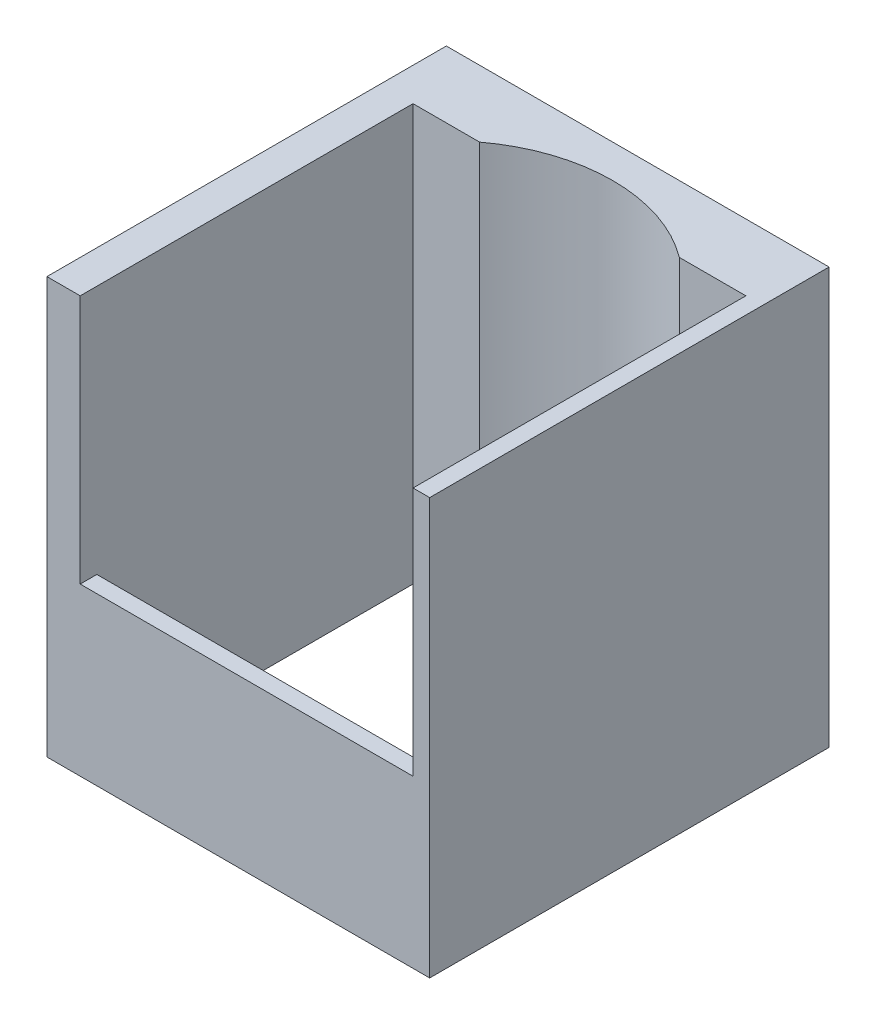
from build123d import *

# Parameters (mm, degrees)
SKETCH1_W                      = 670
SKETCH1_H                      = 120
BOSS_EXTRUDE1_DEPTH            = 530
SKETCH2_W                      = 100
SKETCH2_H                      = 200
SKETCH2_W_2                    = 650
SKETCH2_H_2                    = 250
CUT_EXTRUDE1_DEPTH             = 100
SKETCH3_R                      = 50
CUT_EXTRUDE2_DEPTH             = 260
F_12_0_12_DIAMETER_HOLE2_D     = 12
F_12_0_12_DIAMETER_HOLE2_DEPTH = 30
F_12_0_12_DIAMETER_HOLE2_TIP   = 3.605163714
SKETCH8_W                      = 650
SKETCH8_H                      = 50
BOSS_EXTRUDE2_DEPTH            = 5
SKETCH9_W                      = 10
SKETCH9_H                      = 250
CUT_EXTRUDE3_DEPTH             = 717
CUT_EXTRUDE4_DEPTH             = 5
SKETCH11_W                     = 10
SKETCH11_H                     = 100
BOSS_EXTRUDE3_DEPTH            = 78
BOSS_EXTRUDE3_2_DEPTH          = 78
BOSS_EXTRUDE3_3_DEPTH          = 78
SKETCH12_W                     = 20
SKETCH12_H                     = 30
CUT_EXTRUDE5_DEPTH             = 80
SKETCH15_W                     = 30
SKETCH15_H                     = 23.536156656
SKETCH15_H_2                   = 28.986603691
CUT_EXTRUDE7_DEPTH             = 35
SHELL1_T                       = -3
SKETCH16_W                     = 14
SKETCH16_H                     = 14
CUT_EXTRUDE8_DEPTH             = 35
SKETCH17_W                     = 5.729882812
SKETCH17_H                     = 17.428393554
SKETCH17_W_2                   = 13.369726562
SKETCH17_H_2                   = 3.342431641
BOSS_EXTRUDE4_DEPTH            = 5
SKETCH18_W                     = 670
SKETCH18_H                     = 280
CUT_EXTRUDE10_DEPTH            = 159
CUT_EXTRUDE11_DEPTH            = 863.670273187
CUT_EXTRUDE11_DEPTH_BACK       = 863.670273187
SKETCH19_W                     = 555
SKETCH19_H                     = 250
CUT_EXTRUDE12_DEPTH            = 556.450267801
CUT_EXTRUDE12_DEPTH_BACK       = 556.450267801
SKETCH20_W                     = 115
SKETCH20_H                     = 125


with BuildPart() as part:
    # Sketch1 → Boss-Extrude1 (new body)
    with BuildSketch(Plane(origin=(0, 0, 0), x_dir=(1, 0, 0), z_dir=(0, 1, 0))):
        with Locations((335, 60)):
            Rectangle(SKETCH1_W, SKETCH1_H)
    extrude(amount=BOSS_EXTRUDE1_DEPTH)

    # Sketch2 → Cut-Extrude1 (cut)
    with BuildSketch(Plane.XY):
        with Locations((60, 380)):
            Rectangle(SKETCH2_W, SKETCH2_H)
        with Locations((170, 380)):
            Rectangle(SKETCH2_W, SKETCH2_H)
        with Locations((280, 380)):
            Rectangle(SKETCH2_W, SKETCH2_H)
        with Locations((390, 380)):
            Rectangle(SKETCH2_W, SKETCH2_H)
        with Locations((500, 380)):
            Rectangle(SKETCH2_W, SKETCH2_H)
        with Locations((610, 380)):
            Rectangle(SKETCH2_W, SKETCH2_H)
        with Locations((335, 135)):
            Rectangle(SKETCH2_W_2, SKETCH2_H_2)
    extrude(amount=-CUT_EXTRUDE1_DEPTH, mode=Mode.SUBTRACT)

    # Sketch3 → Cut-Extrude2 (cut)
    with BuildSketch(Plane(origin=(0, 530, 0), x_dir=(1, 0, 0), z_dir=(0, 1, 0))):
        with Locations(Location((60, 60, 0), (0, 0, 270))):
            Circle(SKETCH3_R)
        with Locations(Location((170, 60, 0), (0, 0, 270))):
            Circle(SKETCH3_R)
        with Locations(Location((280, 60, 0), (0, 0, 270))):
            Circle(SKETCH3_R)
        with Locations(Location((390, 60, 0), (0, 0, 270))):
            Circle(SKETCH3_R)
        with Locations(Location((500, 60, 0), (0, 0, 270))):
            Circle(SKETCH3_R)
        with Locations(Location((610, 60, 0), (0, 0, 270))):
            Circle(SKETCH3_R)
    extrude(amount=-CUT_EXTRUDE2_DEPTH, mode=Mode.SUBTRACT)

    # Ø12.0 (12) Diameter Hole2
    with Locations(Plane(origin=(59.704642413, 270, -102.411697903), x_dir=(0, 0, 1), z_dir=(0, 1, 0))):
        with Locations((0, 0), (-0.195888006, 111.8520513), (0.014838595, 221.167624818), (-0.341843303, 331.364008353), (0.657723149, 441.008646429), (1.288998006, 549.811854685)):
            Hole(F_12_0_12_DIAMETER_HOLE2_D / 2, depth=F_12_0_12_DIAMETER_HOLE2_DEPTH)
            with Locations((0, 0, -(F_12_0_12_DIAMETER_HOLE2_DEPTH + F_12_0_12_DIAMETER_HOLE2_TIP / 2))):  # 118° drill point
                Cone(0, F_12_0_12_DIAMETER_HOLE2_D / 2, F_12_0_12_DIAMETER_HOLE2_TIP, mode=Mode.SUBTRACT)

    # Sketch8 → Boss-Extrude2 (add)
    with BuildSketch(Plane.XY):
        with Locations((335, 305)):
            Rectangle(SKETCH8_W, SKETCH8_H)
    extrude(amount=-BOSS_EXTRUDE2_DEPTH)

    # Sketch9 → Cut-Extrude3 (cut)
    with BuildSketch(Plane(origin=(670, 0, 0), x_dir=(0, 0, -1), z_dir=(1, 0, 0))):
        with Locations((15, 135)):
            Rectangle(SKETCH9_W, SKETCH9_H)
    extrude(amount=-CUT_EXTRUDE3_DEPTH, mode=Mode.SUBTRACT)

    # Sketch10 → Cut-Extrude4 (cut)
    with BuildSketch(Plane(origin=(0, 10, 0), x_dir=(1, 0, 0), z_dir=(0, 1, 0))):
        Polygon((365, 61.943560596), (350, 87.924322709), (320, 87.924322709), (305, 61.943560596), (320, 35.962798482), (350, 35.962798482), align=None)
    extrude(amount=-CUT_EXTRUDE4_DEPTH, mode=Mode.SUBTRACT)

    # Sketch12 → Cut-Extrude5 (cut)
    with BuildSketch(Plane.XY.offset(-100)):
        with Locations((85.198613037, 245)):
            Rectangle(SKETCH12_W, SKETCH12_H)
        with Locations((195.198613037, 245)):
            Rectangle(SKETCH12_W, SKETCH12_H)
        with Locations((305.198613037, 245)):
            Rectangle(SKETCH12_W, SKETCH12_H)
        with Locations((415.198613037, 245)):
            Rectangle(SKETCH12_W, SKETCH12_H)
        with Locations((525.198613037, 245)):
            Rectangle(SKETCH12_W, SKETCH12_H)
        with Locations((635.198613037, 245)):
            Rectangle(SKETCH12_W, SKETCH12_H)
    extrude(amount=-CUT_EXTRUDE5_DEPTH, mode=Mode.SUBTRACT)

    # Sketch17 → Boss-Extrude4 (add)
    # profile 1 of 9: a face of its own
    with BuildSketch(Plane.XY):
        with BuildLine():
            Line((527.508830928, 289.835452458), (527.508830928, 307.263846012))
            Line((527.508830928, 307.263846012), (534.861434459, 307.263846012))
            add(Edge.make_bspline(
                [(534.861434459, 307.263846012), (535.181337774, 307.258256848), (535.803061116, 307.24739446), (536.703508491, 307.139069344), (537.544992916, 306.975202489), (538.325061607, 306.737496792), (539.040841948, 306.426020155), (539.698044515, 306.051894954), (540.290333057, 305.605079277), (540.822348212, 305.090232636), (541.284521701, 304.502523111), (541.692171296, 303.852565801), (542.030284458, 303.129762281), (542.309377095, 302.341316546), (542.5243908, 301.484161689), (542.679660381, 300.560045938), (542.773357357, 299.567500804), (542.783368073, 298.883107022), (542.788518428, 298.530997273)],
                knots=[0, 0, 0, 0, 1.135059408, 2.20595691, 3.214417064, 4.174978569, 5.094187092, 5.980001006, 6.853065862, 7.720814779, 8.600404634, 9.50058483, 10.438414914, 11.426825708, 12.465239141, 13.571113463, 14.750376389, 16, 16, 16, 16], degree=3))
            add(Edge.make_bspline(
                [(542.788518428, 298.530997273), (542.781740751, 298.180151665), (542.768592871, 297.499553336), (542.676885992, 296.511518461), (542.516733301, 295.591080531), (542.296748778, 294.736450427), (542.003051046, 293.953120444), (541.654236167, 293.233205539), (541.233025793, 292.585291498), (540.753136904, 292.000029304), (540.204772188, 291.484681411), (539.587651059, 291.044279297), (538.910779309, 290.668464036), (538.169670382, 290.361903209), (537.364073889, 290.124869172), (536.495133477, 289.954199984), (535.562644449, 289.853487388), (534.920131033, 289.841584621), (534.58911581, 289.835452458)],
                knots=[0, 0, 0, 0, 1.228418252, 2.382983832, 3.470276728, 4.496757894, 5.468023682, 6.394867725, 7.292157164, 8.167372942, 9.039072913, 9.918728341, 10.815246345, 11.744296628, 12.720973084, 13.750736166, 14.841206188, 16, 16, 16, 16], degree=3))
            Line((534.58911581, 289.835452458), (527.508830928, 289.835452458))
        make_face()
        with BuildLine():
            Line((533.238713741, 291.745413395), (534.048208904, 291.745413395))
            add(Edge.make_bspline(
                [(534.048208904, 291.745413395), (534.172894012, 291.749291978), (534.413033311, 291.756761998), (534.758676231, 291.825976613), (535.075745017, 291.938271137), (535.365749176, 292.094802589), (535.623404602, 292.300450923), (535.848862806, 292.551404902), (536.04776914, 292.844737637), (536.217685755, 293.190205032), (536.364284647, 293.596533622), (536.481764702, 294.076367921), (536.592118304, 294.630928744), (536.673672739, 295.265507643), (536.740044562, 295.978448886), (536.788346679, 296.768428292), (536.812018936, 297.636801208), (536.817188964, 298.241258393), (536.819890499, 298.55711002)],
                knots=[0, 0, 0, 0, 0.728710832, 1.403472396, 2.052289494, 2.690292559, 3.321919393, 3.970736491, 4.656696891, 5.388631723, 6.217040872, 7.17856157, 8.275589967, 9.523440737, 10.918935818, 12.463926104, 14.152268318, 16, 16, 16, 16], degree=3))
            add(Edge.make_bspline(
                [(536.819890499, 298.55711002), (536.8171426, 298.871715251), (536.811863063, 299.476166083), (536.7886758, 300.343334385), (536.739579947, 301.133216935), (536.674703848, 301.843934916), (536.589660404, 302.476324031), (536.488366458, 303.031681737), (536.362441588, 303.507627045), (536.222158727, 303.914921549), (536.050140993, 304.256514038), (535.858357073, 304.554097881), (535.62547107, 304.79746827), (535.36991257, 305.004888479), (535.079348843, 305.160875844), (534.761320266, 305.273944358), (534.414185903, 305.34216807), (534.172870641, 305.349893944), (534.048208904, 305.353885075)],
                knots=[0, 0, 0, 0, 1.842836665, 3.540640921, 5.080358154, 6.47765669, 7.719902824, 8.816971715, 9.781579111, 10.601733135, 11.334613876, 12.017393917, 12.666641099, 13.29908421, 13.937911793, 14.587567384, 15.270347425, 16, 16, 16, 16], degree=3))
            Line((534.048208904, 305.353885075), (533.238713741, 305.353885075))
            Line((533.238713741, 305.353885075), (533.238713741, 291.745413395))
        make_face(mode=Mode.SUBTRACT)
    # profile 2 of 9: a face of its own
    with BuildSketch(Plane.XY):
        with Locations((547.563420772, 298.549649235)):
            Rectangle(SKETCH17_W, SKETCH17_H)
    # profile 3 of 9: a face of its own
    with BuildSketch(Plane.XY):
        Polygon((564.514324092, 307.263846012), (564.514324092, 305.115139958), (558.545696163, 305.115139958), (558.545696163, 299.862747379), (563.559343624, 299.862747379), (563.559343624, 297.714041325), (558.545696163, 297.714041325), (558.545696163, 289.835452458), (552.81581335, 289.835452458), (552.81581335, 307.263846012), align=None)
    # profile 4 of 9: a face of its own
    with BuildSketch(Plane.XY):
        Polygon((577.645305538, 307.263846012), (577.645305538, 305.115139958), (571.676677608, 305.115139958), (571.676677608, 299.862747379), (576.690325069, 299.862747379), (576.690325069, 297.714041325), (571.676677608, 297.714041325), (571.676677608, 289.835452458), (565.946794795, 289.835452458), (565.946794795, 307.263846012), align=None)
    # profile 5 of 9: a face of its own
    with BuildSketch(Plane.XY):
        with Locations((584.330168819, 287.448001286)):
            Rectangle(SKETCH17_W_2, SKETCH17_H_2)
    # profile 6 of 9: a face of its own
    with BuildSketch(Plane.XY):
        with BuildLine():
            Line((605.578484249, 307.263846012), (605.578484249, 295.602639195))
            add(Edge.make_bspline(
                [(605.578484249, 295.602639195), (605.574209777, 295.35989389), (605.565919345, 294.889083964), (605.480877158, 294.20653885), (605.349958188, 293.569747554), (605.15926554, 292.978838165), (604.911867049, 292.436847071), (604.616163877, 291.936663973), (604.260702644, 291.487723021), (603.847299908, 291.08966617), (603.386881991, 290.731670113), (602.867295001, 290.425440037), (602.293741958, 290.168488385), (601.66690529, 289.960990771), (600.988052682, 289.797299786), (600.254912883, 289.679078851), (599.467035781, 289.60781007), (598.923618241, 289.60048219), (598.643684673, 289.59670734)],
                knots=[0, 0, 0, 0, 1.108173197, 2.149326602, 3.136215123, 4.073726706, 4.978516626, 5.852185058, 6.72141202, 7.584905625, 8.467554395, 9.379216169, 10.332422268, 11.332766067, 12.390653242, 13.518530507, 14.721707419, 16, 16, 16, 16], degree=3))
            add(Edge.make_bspline(
                [(598.643684673, 289.59670734), (598.373688491, 289.600411437), (597.851346557, 289.607577482), (597.093280473, 289.679448684), (596.387523889, 289.797736542), (595.733050135, 289.960122315), (595.130189942, 290.169220301), (594.579048171, 290.42623041), (594.078350789, 290.732835498), (593.633858028, 291.090104794), (593.234289459, 291.486851767), (592.899913678, 291.940746827), (592.609043638, 292.435866034), (592.375223767, 292.980322997), (592.191754821, 293.570441519), (592.063541006, 294.20666921), (591.983676196, 294.889343196), (591.974661767, 295.359932437), (591.970012569, 295.602639195)],
                knots=[0, 0, 0, 0, 1.258901956, 2.435505865, 3.547148904, 4.59359074, 5.576649289, 6.5183682, 7.424469602, 8.307507093, 9.172751023, 10.042627298, 10.928839176, 11.845659241, 12.799442865, 13.80597989, 14.868432463, 16, 16, 16, 16], degree=3))
            Line((591.970012569, 295.602639195), (591.970012569, 307.263846012))
            Line((591.970012569, 307.263846012), (597.699895381, 307.263846012))
            Line((597.699895381, 307.263846012), (597.699895381, 295.457153889))
            add(Edge.make_bspline(
                [(597.699895381, 295.457153889), (597.700816195, 295.287996189), (597.702584578, 294.963135903), (597.729908723, 294.499051493), (597.768241004, 294.079064133), (597.828226169, 293.705517832), (597.90066041, 293.377063412), (597.989882091, 293.09281535), (598.094998068, 292.852496478), (598.225239063, 292.654232043), (598.380826623, 292.495135011), (598.55368342, 292.353231761), (598.757556996, 292.238543846), (598.987648905, 292.146224908), (599.243380948, 292.070549638), (599.526120553, 292.020376099), (599.83553351, 291.990763905), (600.049971942, 291.986424568), (600.161954402, 291.984158512)],
                knots=[0, 0, 0, 0, 1.622370975, 3.115695595, 4.458049099, 5.666011203, 6.742434742, 7.681714947, 8.519814998, 9.250928664, 9.942747364, 10.646898194, 11.389596108, 12.175933929, 13.021386247, 13.943159715, 14.925891993, 16, 16, 16, 16], degree=3))
            add(Edge.make_bspline(
                [(600.161954402, 291.984158512), (600.283927219, 291.987190593), (600.521124756, 291.993087005), (600.86597014, 292.03390861), (601.187714881, 292.103380086), (601.484890424, 292.205377303), (601.758665297, 292.332852529), (602.012761516, 292.484567923), (602.236391413, 292.674631152), (602.439076761, 292.888441291), (602.620738276, 293.128529789), (602.771757722, 293.399928575), (602.905501548, 293.697121508), (603.005823683, 294.025060118), (603.089837826, 294.379999499), (603.146989706, 294.763086929), (603.186210275, 295.174074524), (603.189394751, 295.457053988), (603.191033077, 295.602639195)],
                knots=[0, 0, 0, 0, 1.083870311, 2.107775948, 3.08105344, 4.003637981, 4.893545291, 5.761570557, 6.624657808, 7.49233129, 8.376387281, 9.291996285, 10.246843261, 11.267344133, 12.334180325, 13.486053461, 14.706643157, 16, 16, 16, 16], degree=3))
            Line((603.191033077, 295.602639195), (603.191033077, 307.263846012))
            Line((603.191033077, 307.263846012), (605.578484249, 307.263846012))
        make_face()
    # profile 7 of 9: a face of its own
    with BuildSketch(Plane.XY):
        with BuildLine():
            Line((619.731593227, 302.015183827), (616.739818477, 301.526502415))
            add(Edge.make_bspline(
                [(616.739818477, 301.526502415), (616.748849224, 301.670726223), (616.765660669, 301.939210177), (616.78429066, 302.312269209), (616.796668381, 302.625642376), (616.798628236, 302.814722915), (616.799504756, 302.899286839)],
                knots=[0, 0, 0, 0, 1.261802504, 2.348944521, 3.261585937, 4, 4, 4, 4], degree=3))
            add(Edge.make_bspline(
                [(616.799504756, 302.899286839), (616.798306068, 303.007660677), (616.795968139, 303.219033721), (616.750451916, 303.523894877), (616.694806916, 303.811547356), (616.604352699, 304.076787391), (616.488181329, 304.320314265), (616.348943917, 304.543955606), (616.184187178, 304.745078709), (615.995833421, 304.928129987), (615.778009957, 305.083200131), (615.536269472, 305.218702836), (615.269765326, 305.333844758), (614.978065514, 305.431346685), (614.660683072, 305.504624438), (614.319025281, 305.556776695), (613.952471696, 305.585673441), (613.699597795, 305.590260771), (613.568984889, 305.592630192)],
                knots=[0, 0, 0, 0, 1.079280541, 2.105035848, 3.067950317, 3.99715044, 4.889989748, 5.753421302, 6.617030865, 7.476358039, 8.364190572, 9.274590025, 10.235106994, 11.254473582, 12.337095886, 13.478601727, 14.697662529, 16, 16, 16, 16], degree=3))
            add(Edge.make_bspline(
                [(613.568984889, 305.592630192), (613.391954632, 305.58912286), (613.059112606, 305.582528579), (612.595688488, 305.495339748), (612.198743126, 305.361419257), (611.87165349, 305.163811893), (611.613188167, 304.909795747), (611.433841092, 304.593316589), (611.323009072, 304.224665915), (611.313400221, 303.959558324), (611.308367061, 303.820693775)],
                knots=[0, 0, 0, 0, 1.294917039, 2.43462794, 3.440028966, 4.347597256, 5.210608309, 6.06356377, 6.985685997, 8, 8, 8, 8], degree=3))
            add(Edge.make_bspline(
                [(611.308367061, 303.820693775), (611.317562032, 303.705133219), (611.336106628, 303.472068433), (611.47315858, 303.132808312), (611.695999602, 302.811560885), (612.009295906, 302.510664216), (612.404107796, 302.221967273), (612.884407504, 301.948533431), (613.450813789, 301.688189695), (613.862519081, 301.536023727), (614.080048656, 301.455624958)],
                knots=[0, 0, 0, 0, 0.716839541, 1.445735977, 2.240793036, 3.131329288, 4.131129903, 5.273471266, 6.559404876, 8, 8, 8, 8], degree=3))
            add(Edge.make_bspline(
                [(614.080048656, 301.455624958), (614.335934702, 301.364918412), (614.834564244, 301.188164095), (615.547657928, 300.88707802), (616.213068388, 300.5749594), (616.829579094, 300.246613346), (617.397833174, 299.90520698), (617.914851624, 299.544556457), (618.386199073, 299.173962102), (618.807001026, 298.783874588), (619.177995113, 298.378100064), (619.4958685, 297.952745357), (619.771807525, 297.51723103), (619.991113975, 297.061458502), (620.169645242, 296.594624218), (620.292698657, 296.11024444), (620.364288243, 295.609761088), (620.37516617, 295.270864226), (620.380681514, 295.099036213)],
                knots=[0, 0, 0, 0, 1.359488612, 2.649152603, 3.874964776, 5.039588756, 6.146130126, 7.193090393, 8.194917302, 9.146793662, 10.063845301, 10.944476293, 11.803344532, 12.641736646, 13.473440096, 14.302714936, 15.139439897, 16, 16, 16, 16], degree=3))
            add(Edge.make_bspline(
                [(620.380681514, 295.099036213), (620.374476075, 294.902306495), (620.362285176, 294.515820995), (620.280160209, 293.948630617), (620.138011896, 293.409496554), (619.938489338, 292.895972278), (619.681049879, 292.411946655), (619.366518754, 291.954381076), (618.996510229, 291.525099427), (618.5710008, 291.128381035), (618.102222518, 290.765302239), (617.587803957, 290.450854345), (617.034458515, 290.187092261), (616.444107988, 289.968993032), (615.81453624, 289.801373099), (615.145337453, 289.685291013), (614.438790193, 289.606619894), (613.954683001, 289.600062276), (613.70700941, 289.59670734)],
                knots=[0, 0, 0, 0, 0.972121714, 1.909782367, 2.824924061, 3.721832975, 4.62620438, 5.527836938, 6.46026819, 7.421000932, 8.398101015, 9.385579713, 10.394244048, 11.422703992, 12.491421888, 13.608778581, 14.776629625, 16, 16, 16, 16], degree=3))
            add(Edge.make_bspline(
                [(613.70700941, 289.59670734), (613.445745367, 289.599650312), (612.939893069, 289.605348413), (612.207608113, 289.66709241), (611.525297432, 289.760984454), (610.893395078, 289.899706116), (610.309273131, 290.072394336), (609.776099392, 290.288320955), (609.295310255, 290.547303481), (608.863217672, 290.843007892), (608.478306623, 291.175775461), (608.148120946, 291.551766865), (607.86942369, 291.967163224), (607.639947144, 292.421521488), (607.466477665, 292.917583541), (607.339164663, 293.449829748), (607.264537999, 294.021332449), (607.254747521, 294.414908557), (607.249700069, 294.617815586)],
                knots=[0, 0, 0, 0, 1.342201143, 2.598733168, 3.773451092, 4.878874364, 5.91991243, 6.900006476, 7.829142054, 8.72062616, 9.585588575, 10.436728592, 11.283829734, 12.149664931, 13.044964919, 13.977937424, 14.957531465, 16, 16, 16, 16], degree=3))
            add(Edge.make_bspline(
                [(607.249700069, 294.617815586), (607.250803815, 294.692425759), (607.253213998, 294.855347393), (607.260452266, 295.122772538), (607.275636683, 295.433682216), (607.29037174, 295.656130545), (607.298195171, 295.774237248)],
                knots=[0, 0, 0, 0, 0.773500207, 1.689044709, 2.77302154, 4, 4, 4, 4], degree=3))
            Line((607.298195171, 295.774237248), (610.36457777, 296.337526509))
            add(Edge.make_bspline(
                [(610.36457777, 296.337526509), (610.326952988, 296.136337493), (610.255606535, 295.754830366), (610.178678473, 295.21219969), (610.124206629, 294.733311493), (610.11767002, 294.435147371), (610.114641475, 294.297001835)],
                knots=[0, 0, 0, 0, 1.192988372, 2.262218769, 3.194850416, 4, 4, 4, 4], degree=3))
            add(Edge.make_bspline(
                [(610.114641475, 294.297001835), (610.116191817, 294.183708768), (610.119182568, 293.965156219), (610.159053378, 293.648552813), (610.215988606, 293.352999663), (610.302906772, 293.079707227), (610.411206928, 292.826307836), (610.544682453, 292.59538211), (610.704385489, 292.386485019), (610.887496571, 292.200099922), (611.094689168, 292.033628705), (611.327456494, 291.892756696), (611.58347653, 291.771733922), (611.864681562, 291.677479524), (612.167961721, 291.596080628), (612.497219749, 291.548235723), (612.849461228, 291.512043782), (613.092629543, 291.508500084), (613.218327999, 291.506668278)],
                knots=[0, 0, 0, 0, 1.135776692, 2.191015738, 3.19649269, 4.151244236, 5.061952528, 5.956281389, 6.819534407, 7.692823504, 8.571441916, 9.478554956, 10.416037156, 11.406231466, 12.450054172, 13.561596327, 14.739541482, 16, 16, 16, 16], degree=3))
            add(Edge.make_bspline(
                [(613.218327999, 291.506668278), (613.423996012, 291.510791273), (613.810619321, 291.518541853), (614.349272542, 291.616708407), (614.810575885, 291.768742445), (615.189785268, 291.991387532), (615.490778961, 292.278756613), (615.698005174, 292.637320004), (615.824813318, 293.05638326), (615.837728413, 293.355975238), (615.844524288, 293.513619419)],
                knots=[0, 0, 0, 0, 1.308765556, 2.460272085, 3.475015317, 4.388076298, 5.239673503, 6.095681635, 6.997954785, 8, 8, 8, 8], degree=3))
            add(Edge.make_bspline(
                [(615.844524288, 293.513619419), (615.833808824, 293.638242951), (615.811807312, 293.894126055), (615.644884004, 294.264515838), (615.382382362, 294.620631473), (615.016807277, 294.962984909), (614.551376589, 295.293471235), (613.986957743, 295.616730224), (613.322148235, 295.933112033), (612.83677959, 296.119639164), (612.580430889, 296.21815395)],
                knots=[0, 0, 0, 0, 0.667930748, 1.371427933, 2.146459016, 3.034714139, 4.04893387, 5.207327294, 6.525042705, 8, 8, 8, 8], degree=3))
            add(Edge.make_bspline(
                [(612.580430889, 296.21815395), (612.374354345, 296.29679374), (611.970646869, 296.450850434), (611.394079385, 296.713586304), (610.853066711, 296.987016804), (610.357486361, 297.288235735), (609.896382561, 297.599610528), (609.477036946, 297.932256792), (609.09841673, 298.284556341), (608.758710772, 298.653375077), (608.457302107, 299.038989264), (608.199448649, 299.444659231), (607.977533299, 299.866789834), (607.798609588, 300.308107488), (607.65975715, 300.767821241), (607.559616231, 301.244439392), (607.497905054, 301.739995674), (607.491630423, 302.075933546), (607.488445186, 302.246468159)],
                knots=[0, 0, 0, 0, 1.249558333, 2.447906163, 3.58867143, 4.682264114, 5.731748367, 6.739728761, 7.711906036, 8.659384707, 9.578321416, 10.481344598, 11.379544271, 12.277135726, 13.175418307, 14.097160112, 15.034047388, 16, 16, 16, 16], degree=3))
            add(Edge.make_bspline(
                [(607.488445186, 302.246468159), (607.49282555, 302.439538736), (607.501402184, 302.817565692), (607.587451154, 303.36980586), (607.719291893, 303.894921371), (607.910558542, 304.389343064), (608.156192894, 304.852853762), (608.453187669, 305.288766511), (608.804241719, 305.697593471), (609.213503754, 306.066686531), (609.657214714, 306.407618241), (610.14376173, 306.697651931), (610.658716537, 306.950861947), (611.210636666, 307.148827868), (611.791820619, 307.313252612), (612.408080529, 307.421140415), (613.056315391, 307.490701612), (613.499160755, 307.498567824), (613.725661373, 307.502591129)],
                knots=[0, 0, 0, 0, 1.01033566, 1.978209831, 2.919499157, 3.840961976, 4.746855014, 5.660740114, 6.597989116, 7.56120833, 8.541877795, 9.523498025, 10.522416858, 11.542172371, 12.589598349, 13.681636521, 14.814234488, 16, 16, 16, 16], degree=3))
            add(Edge.make_bspline(
                [(613.725661373, 307.502591129), (613.968269855, 307.498219033), (614.438190994, 307.489750488), (615.120391152, 307.426787419), (615.755073228, 307.319142339), (616.345153155, 307.171557286), (616.887304575, 306.977590666), (617.384933999, 306.742393454), (617.834452216, 306.46201507), (618.236961315, 306.139451502), (618.593086714, 305.773322851), (618.897467704, 305.361641069), (619.158701245, 304.909408454), (619.366684143, 304.412232174), (619.529870326, 303.873247147), (619.649133834, 303.29158184), (619.720420497, 302.667301443), (619.72779778, 302.236712324), (619.731593227, 302.015183827)],
                knots=[0, 0, 0, 0, 1.248314423, 2.417925914, 3.521398822, 4.558068205, 5.543720209, 6.479599284, 7.385061127, 8.263440163, 9.127722873, 10.00561236, 10.891325273, 11.808802823, 12.772251995, 13.784947978, 14.860405143, 16, 16, 16, 16], degree=3))
        make_face()
    # profile 8 of 9: a face of its own
    with BuildSketch(Plane.XY):
        Polygon((633.989153194, 307.263846012), (633.989153194, 305.115139958), (628.020525264, 305.115139958), (628.020525264, 300.340237614), (633.034172725, 300.340237614), (633.034172725, 298.191531559), (628.020525264, 298.191531559), (628.020525264, 291.984158512), (634.944133663, 291.984158512), (634.944133663, 289.835452458), (622.290642452, 289.835452458), (622.290642452, 307.263846012), align=None)
    # profile 9 of 9: a face of its own
    with BuildSketch(Plane.XY):
        with BuildLine():
            Line((636.376604366, 289.835452458), (636.376604366, 307.263846012))
            Line((636.376604366, 307.263846012), (643.990335369, 307.263846012))
            add(Edge.make_bspline(
                [(643.990335369, 307.263846012), (644.237946498, 307.261150834), (644.721600887, 307.25588639), (645.426490561, 307.189203683), (646.094808274, 307.090496236), (646.724915796, 306.949857504), (647.317873659, 306.767252686), (647.871119087, 306.542146), (648.390701058, 306.282329135), (648.864494846, 305.976472528), (649.295093616, 305.642889252), (649.669668547, 305.279483604), (649.990389523, 304.894749072), (650.250664962, 304.483256345), (650.454275633, 304.048690948), (650.59581384, 303.587791605), (650.684089268, 303.104102537), (650.695510601, 302.772834174), (650.701311397, 302.604585835)],
                knots=[0, 0, 0, 0, 1.303269877, 2.545653735, 3.724355284, 4.8584284, 5.941462088, 6.987020715, 8.000098032, 8.995332524, 9.951400474, 10.863507538, 11.737823931, 12.582415999, 13.420128714, 14.25671499, 15.114600608, 16, 16, 16, 16], degree=3))
            add(Edge.make_bspline(
                [(650.701311397, 302.604585835), (650.698282873, 302.472674957), (650.692382063, 302.215658276), (650.651041486, 301.838684287), (650.580643818, 301.480313933), (650.481036683, 301.139915259), (650.347814833, 300.820175594), (650.191279492, 300.517863507), (650.009772227, 300.230553342), (649.788675198, 299.970497982), (649.548268341, 299.722842359), (649.274558803, 299.497116911), (648.974487035, 299.288655528), (648.642526299, 299.104010513), (648.287619671, 298.928055749), (647.899038177, 298.784921972), (647.486819978, 298.644749395), (647.19793098, 298.577036306), (647.049257183, 298.54218845)],
                knots=[0, 0, 0, 0, 1.057156483, 2.059775939, 3.035078039, 3.981068617, 4.897189472, 5.80650904, 6.70770952, 7.613691521, 8.536886357, 9.470937334, 10.45233069, 11.461024139, 12.51295332, 13.623444893, 14.776929983, 16, 16, 16, 16], degree=3))
            add(Edge.make_bspline(
                [(647.049257183, 298.54218845), (647.19164695, 298.499279419), (647.467865022, 298.416041346), (647.856360945, 298.265600017), (648.211652989, 298.111536308), (648.524185739, 297.936781388), (648.807636894, 297.762122504), (649.047122259, 297.564301324), (649.255235567, 297.361673563), (649.425188343, 297.135464734), (649.570253643, 296.882344437), (649.694827156, 296.586596707), (649.815179167, 296.247423665), (649.917667348, 295.859098311), (650.004750555, 295.423699276), (650.088222437, 294.944027189), (650.153853601, 294.416024546), (650.187587341, 294.048412906), (650.2051692, 293.856815525)],
                knots=[0, 0, 0, 0, 1.149282524, 2.229462177, 3.219229774, 4.139917433, 4.995948464, 5.788695735, 6.536448429, 7.236319808, 7.968460079, 8.78645307, 9.713791991, 10.749194692, 11.887975363, 13.146018663, 14.512518948, 16, 16, 16, 16], degree=3))
            add(Edge.make_bspline(
                [(650.2051692, 293.856815525), (650.225980287, 293.627849833), (650.265975604, 293.187817268), (650.348933081, 292.554613589), (650.44386163, 291.974357025), (650.555874504, 291.44528724), (650.681301216, 290.967898855), (650.821280597, 290.540469593), (650.979920039, 290.165788217), (651.10484481, 289.941461656), (651.163880062, 289.835452458)],
                knots=[0, 0, 0, 0, 1.324580516, 2.545615266, 3.678710841, 4.711533017, 5.660403917, 6.521349952, 7.301239649, 8, 8, 8, 8], degree=3))
            Line((651.163880062, 289.835452458), (645.213904094, 289.835452458))
            add(Edge.make_bspline(
                [(645.213904094, 289.835452458), (645.12229736, 290.069847279), (644.935171241, 290.548648246), (644.7595281, 291.319414791), (644.64846922, 292.142514735), (644.635117598, 292.70994511), (644.628232479, 293.002555653)],
                knots=[0, 0, 0, 0, 0.930410518, 1.900560147, 2.917368081, 4, 4, 4, 4], degree=3))
            Line((644.628232479, 293.002555653), (644.605850124, 294.002300831))
            Line((644.605850124, 294.002300831), (644.579737377, 295.266903874))
            add(Edge.make_bspline(
                [(644.579737377, 295.266903874), (644.573694669, 295.477395004), (644.562357007, 295.872330118), (644.469348432, 296.426164013), (644.30178735, 296.894645884), (644.073222546, 297.287223005), (643.766741442, 297.590613479), (643.39104803, 297.804152917), (642.950456912, 297.93396284), (642.634664848, 297.946292392), (642.468335247, 297.952786442)],
                knots=[0, 0, 0, 0, 1.295300309, 2.430314163, 3.439929415, 4.342995669, 5.203512789, 6.060756153, 6.978588463, 8, 8, 8, 8], degree=3))
            Line((642.468335247, 297.952786442), (642.106487178, 297.952786442))
            Line((642.106487178, 297.952786442), (642.106487178, 289.835452458))
            Line((642.106487178, 289.835452458), (636.376604366, 289.835452458))
        make_face()
        with BuildLine():
            Line((642.106487178, 299.862747379), (642.617550945, 299.862747379))
            add(Edge.make_bspline(
                [(642.617550945, 299.862747379), (642.722054451, 299.865172716), (642.925280724, 299.869889229), (643.220054897, 299.898289891), (643.494111408, 299.951809873), (643.749840966, 300.021017819), (643.984372137, 300.114851792), (644.200147241, 300.225818296), (644.391160406, 300.362685327), (644.565327067, 300.516342321), (644.718148635, 300.691986294), (644.850351299, 300.889034217), (644.961199162, 301.106225057), (645.056078491, 301.342818683), (645.125883912, 301.600830857), (645.173262731, 301.879472914), (645.203404658, 302.177423605), (645.207875435, 302.383174491), (645.210173702, 302.488943669)],
                knots=[0, 0, 0, 0, 1.184986479, 2.304423995, 3.352332712, 4.347714965, 5.303263624, 6.211353909, 7.091434645, 7.960150225, 8.839440182, 9.723126897, 10.64371617, 11.599264829, 12.608232147, 13.667459739, 14.800924404, 16, 16, 16, 16], degree=3))
            add(Edge.make_bspline(
                [(645.210173702, 302.488943669), (645.207875435, 302.594712847), (645.203404658, 302.800463732), (645.173262731, 303.098414423), (645.125883912, 303.37705648), (645.056078491, 303.635068654), (644.961199162, 303.87166228), (644.850351299, 304.08885312), (644.718148635, 304.285901043), (644.565327067, 304.461545017), (644.391160406, 304.61520201), (644.200147241, 304.752069041), (643.984372137, 304.863035546), (643.749840966, 304.956869518), (643.494111408, 305.026077464), (643.220054897, 305.079597446), (642.925280724, 305.107998108), (642.722054451, 305.112714621), (642.617550945, 305.115139958)],
                knots=[0, 0, 0, 0, 1.199075596, 2.332540261, 3.391767853, 4.400735171, 5.35628383, 6.276873103, 7.160559818, 8.039849775, 8.908565355, 9.788646091, 10.696736376, 11.652285035, 12.647667288, 13.695576005, 14.815013521, 16, 16, 16, 16], degree=3))
            Line((642.617550945, 305.115139958), (642.106487178, 305.115139958))
            Line((642.106487178, 305.115139958), (642.106487178, 299.862747379))
        make_face(mode=Mode.SUBTRACT)
    extrude(amount=BOSS_EXTRUDE4_DEPTH)


with BuildPart() as body_2:
    # Sketch11 → Boss-Extrude3 (new body)
    with BuildSketch(Plane.XY.offset(-100)):
        with Locations((255, 60)):
            Rectangle(SKETCH11_W, SKETCH11_H)
    extrude(amount=BOSS_EXTRUDE3_DEPTH)


with BuildPart() as body_3:
    # Sketch11 → Boss-Extrude3 2 (new body)
    with BuildSketch(Plane.XY.offset(-100)):
        with Locations((415, 60)):
            Rectangle(SKETCH11_W, SKETCH11_H)
    extrude(amount=BOSS_EXTRUDE3_2_DEPTH)


with BuildPart() as body_4:
    # Sketch11 → Boss-Extrude3 3 (new body)
    with BuildSketch(Plane.XY.offset(-100)):
        Polygon((25, 198.45686471), (325, 145.558770497), (325, 122.01775856), (345, 122.01775856), (345, 145.558770497), (645, 198.45686471), align=None)
    extrude(amount=BOSS_EXTRUDE3_3_DEPTH)

    # Sketch15 → Cut-Extrude7 (cut)
    with BuildSketch(Plane(origin=(345, 0, 0), x_dir=(0, 0, -1), z_dir=(1, 0, 0))):
        with Locations((35, 133.231921672)):
            Rectangle(SKETCH15_W, SKETCH15_H)
        with Locations((85, 130.506698154)):
            Rectangle(SKETCH15_W, SKETCH15_H_2)
    extrude(amount=-CUT_EXTRUDE7_DEPTH, mode=Mode.SUBTRACT)

    # Shell1
    shell1_openings = [body_4.faces().sort_by_distance(p)[0] for p in [
        (335, 198.45686471, -61),
    ]]
    offset(amount=SHELL1_T, openings=shell1_openings, kind=Kind.INTERSECTION)

    # Sketch16 → Cut-Extrude8 (cut)
    with BuildSketch(Plane.XZ.offset(-122.01775856)):
        with Locations((335, -60)):
            Rectangle(SKETCH16_W, SKETCH16_H)
    extrude(amount=-CUT_EXTRUDE8_DEPTH, mode=Mode.SUBTRACT)


with BuildPart() as cut_extrude10_tool:
    # Sketch18 → Cut-Extrude10 (new body)
    with BuildSketch(Plane.XY):
        with Locations((335, 140)):
            Rectangle(SKETCH18_W, SKETCH18_H)
    extrude(amount=-CUT_EXTRUDE10_DEPTH)


with BuildPart() as part_1:
    add(part.part)

    # Cut-Extrude10: cut by cut_extrude10_tool
    add(cut_extrude10_tool.part, mode=Mode.SUBTRACT)

    # Sketch19 → Cut-Extrude11 (cut, two sides: drawn at the far end of the back side and taken through both)
    with BuildSketch(Plane.XY.offset(-CUT_EXTRUDE11_DEPTH_BACK)):
        with Locations((392.5, 405)):
            Rectangle(SKETCH19_W, SKETCH19_H)
    extrude(amount=CUT_EXTRUDE11_DEPTH + CUT_EXTRUDE11_DEPTH_BACK, mode=Mode.SUBTRACT)

    # Sketch20 → Cut-Extrude12 (cut, two sides: drawn at the far end of the back side and taken through both)
    with BuildSketch(Plane.XY.offset(-CUT_EXTRUDE12_DEPTH_BACK)):
        with Locations((57.5, 467.5)):
            Rectangle(SKETCH20_W, SKETCH20_H)
    extrude(amount=CUT_EXTRUDE12_DEPTH + CUT_EXTRUDE12_DEPTH_BACK, mode=Mode.SUBTRACT)


with BuildPart() as body_2_1:
    add(body_2.part)

    # Cut-Extrude10: cut by cut_extrude10_tool
    add(cut_extrude10_tool.part, mode=Mode.SUBTRACT)


with BuildPart() as body_3_1:
    add(body_3.part)

    # Cut-Extrude10: cut by cut_extrude10_tool
    add(cut_extrude10_tool.part, mode=Mode.SUBTRACT)


with BuildPart() as body_4_1:
    add(body_4.part)

    # Cut-Extrude10: cut by cut_extrude10_tool
    add(cut_extrude10_tool.part, mode=Mode.SUBTRACT)


solid = part_1.part
